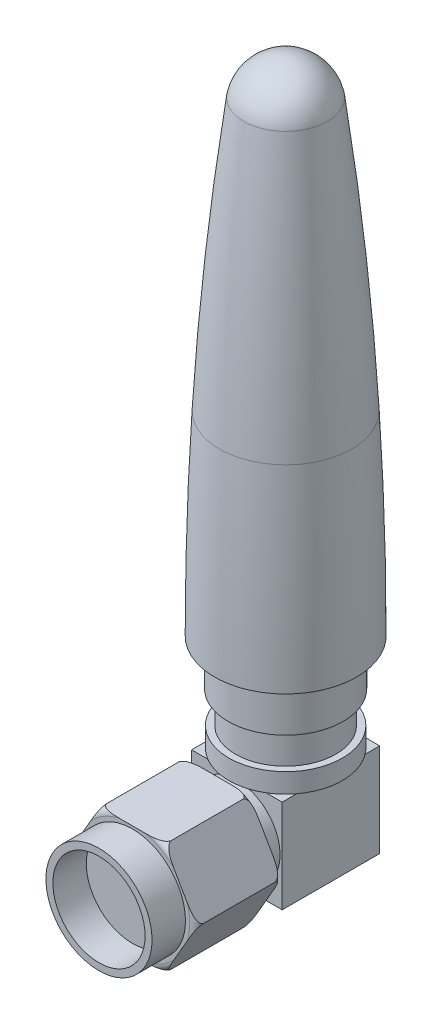
from build123d import *

# Parameters (mm, degrees)
SKETCH1_R           = 3.81
SKETCH1_R_2         = 3.31
BOSS_EXTRUDE1_DEPTH = 2.4
BOSS_EXTRUDE2_DEPTH = 6.1
SKETCH4_R           = 3.1
BOSS_EXTRUDE3_DEPTH = 1.4
SKETCH5_W           = 6.5
SKETCH5_H           = 6.7
BOSS_EXTRUDE4_DEPTH = 7
SKETCH6_R           = 2.5
SKETCH6_R_2         = 2.45
CUT_EXTRUDE1_DEPTH  = 7
CUT_EXTRUDE2_DEPTH  = 0.5
SKETCH8_R           = 4.075
BOSS_EXTRUDE5_DEPTH = 1.4
SKETCH9_R           = 3.6
BOSS_EXTRUDE6_DEPTH = 2.3
SKETCH10_R          = 4.125
BOSS_EXTRUDE7_DEPTH = 3.25


with BuildPart() as part:
    # Sketch1 → Boss-Extrude1 (new body)
    with BuildSketch(Plane.XY):
        Circle(SKETCH1_R)
        Circle(SKETCH1_R_2, mode=Mode.SUBTRACT)
    extrude(amount=BOSS_EXTRUDE1_DEPTH)

    # Sketch2 → Boss-Extrude2 (add)
    with BuildSketch(Plane(origin=(0, 0, 0), x_dir=(-1, 0, 0), z_dir=(0, 0, -1))):
        Polygon((2.309401077, -4), (4.618802154, 0), (2.309401077, 4), (-2.309401077, 4), (-4.618802154, 0), (-2.309401077, -4), align=None)
    extrude(amount=BOSS_EXTRUDE2_DEPTH)

    # Sketch3 → Cut-Revolve1 (revolve, cut)
    with BuildSketch(Plane(origin=(0, 0, 0), x_dir=(1, 0, 0), z_dir=(0, 1, 0))):
        with BuildLine():
            Line((-4.618802154, 5.6), (-4.618802154, 6.1))
            Line((-4.618802154, 6.1), (-4.118802154, 6.1))
            ThreePointArc((-4.118802154, 6.1), (-4.472355544, 5.953553391), (-4.618802154, 5.6))
        make_face()
        with BuildLine():
            Line((-4.618802154, 0), (-4.118802154, 0))
            ThreePointArc((-4.118802154, 0), (-4.472355544, 0.146446609), (-4.618802154, 0.5))
            Line((-4.618802154, 0.5), (-4.618802154, 0))
        make_face()
    revolve(axis=Axis((0, 0, 0), (0, 0, -1)), mode=Mode.SUBTRACT)

    # Sketch4 → Boss-Extrude3 (add)
    with BuildSketch(Plane(origin=(0, 0, -6.1), x_dir=(-1, 0, 0), z_dir=(0, 0, -1))):
        Circle(SKETCH4_R)
    extrude(amount=BOSS_EXTRUDE3_DEPTH)

    # Sketch5 → Boss-Extrude4 (add)
    with BuildSketch(Plane(origin=(0, 0, -7.5), x_dir=(-1, 0, 0), z_dir=(0, 0, -1))):
        Rectangle(SKETCH5_W, SKETCH5_H)
    extrude(amount=BOSS_EXTRUDE4_DEPTH)

    # Sketch6 → Cut-Extrude1 (cut)
    with BuildSketch(Plane(origin=(0, 0, -14.5), x_dir=(-1, 0, 0), z_dir=(0, 0, -1))):
        Circle(SKETCH6_R)
        Circle(SKETCH6_R_2, mode=Mode.SUBTRACT)
    extrude(amount=-CUT_EXTRUDE1_DEPTH, mode=Mode.SUBTRACT)

    # Sketch7 → Cut-Extrude2 (cut)
    with BuildSketch(Plane(origin=(0, 0, -14.5), x_dir=(-1, 0, 0), z_dir=(0, 0, -1))):
        with BuildLine():
            Line((1.462150124, 2.027835549), (-2.027835549, -1.462150124))
            ThreePointArc((-2.027835549, -1.462150124), (-1.767766953, -1.767766953), (-1.462150124, -2.027835549))
            Line((-1.462150124, -2.027835549), (2.027835549, 1.462150124))
            ThreePointArc((2.027835549, 1.462150124), (1.767766953, 1.767766953), (1.462150124, 2.027835549))
        make_face()
    extrude(amount=-CUT_EXTRUDE2_DEPTH, mode=Mode.SUBTRACT)

    # Sketch8 → Boss-Extrude5 (add)
    with BuildSketch(Plane(origin=(0, 3.35, 0), x_dir=(1, 0, 0), z_dir=(0, 1, 0))):
        with Locations(Location((0, 11, 0), (0, 0, 59.192817964))):
            Circle(SKETCH8_R)
    extrude(amount=BOSS_EXTRUDE5_DEPTH)

    # Sketch9 → Boss-Extrude6 (add)
    with BuildSketch(Plane(origin=(0, 4.75, 0), x_dir=(1, 0, 0), z_dir=(0, 1, 0))):
        with Locations(Location((0, 11, 0), (0, 0, 270))):
            Circle(SKETCH9_R)
    extrude(amount=BOSS_EXTRUDE6_DEPTH)

    # Sketch10 → Boss-Extrude7 (add)
    with BuildSketch(Plane(origin=(0, 7.05, 0), x_dir=(1, 0, 0), z_dir=(0, 1, 0))):
        with Locations(Location((0, 11, 0), (0, 0, 90))):
            Circle(SKETCH10_R)
    extrude(amount=BOSS_EXTRUDE7_DEPTH)

    # Sketch11 → Revolve1 (revolve)
    with BuildSketch(Plane(origin=(0, 0, 0), x_dir=(0, 0, -1), z_dir=(1, 0, 0)), mode=Mode.PRIVATE) as revolve1_sk:
        with BuildLine():
            Line((11, 10.3), (5.9, 10.3))
            ThreePointArc((5.9, 10.3), (5.987513668, 17.302187158), (6.25, 24.3))
            ThreePointArc((6.25, 24.3), (6.932343055, 34.067289726), (8, 43.8))
            ThreePointArc((8, 43.8), (9.047437581, 45.593074903), (11, 46.3))
            Line((11, 46.3), (11, 10.3))
        make_face()
    revolve(revolve1_sk.sketch.rotate(Axis((0, 10.3, -11), (0, 1, 0)), 180), axis=Axis((0, 10.3, -11), (0, 1, 0)))


solid = part.part
